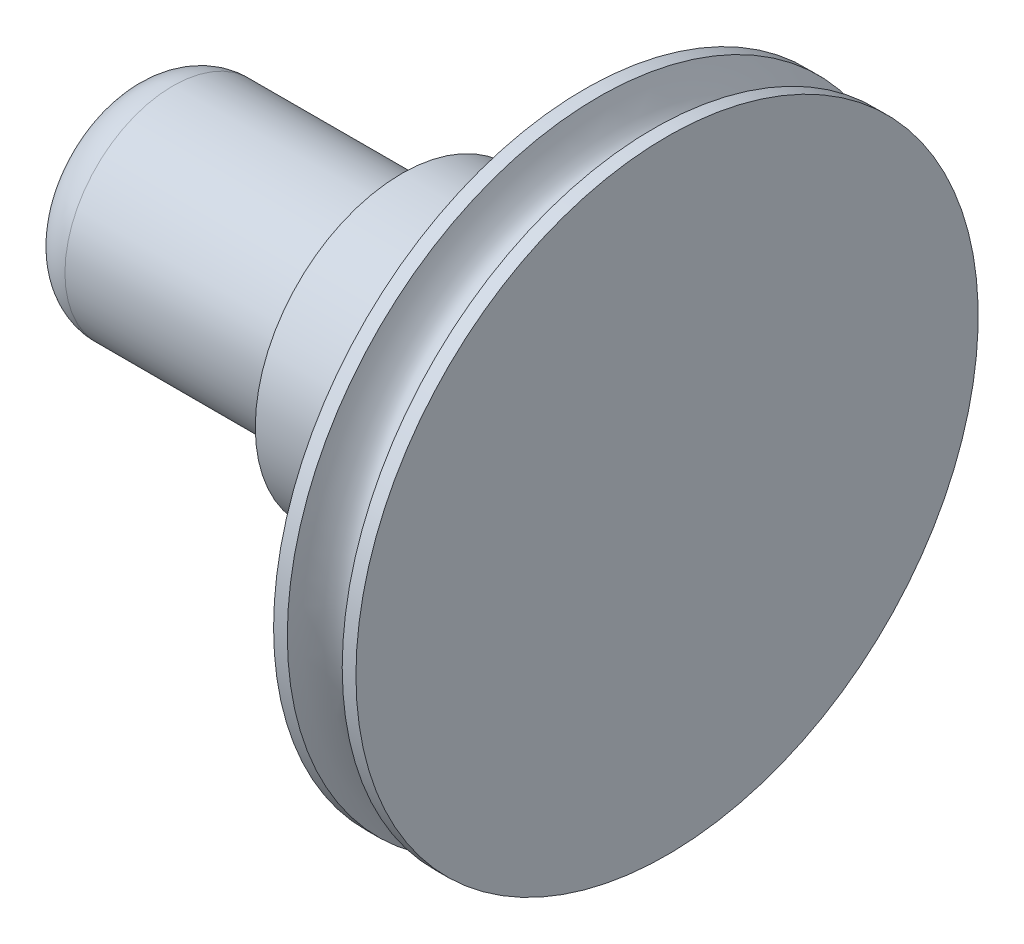
from build123d import *

# Parameters (mm, degrees)
FILLET1_R = 2.5


with BuildPart() as part:
    # Sketch1 → Revolve1 (revolve)
    with BuildSketch(Plane(origin=(0, 0, 0), x_dir=(1, 0, 0), z_dir=(0, 1, 0)), mode=Mode.PRIVATE) as revolve1_sk:
        with BuildLine():
            Line((0, 0), (4.5, 0))
            Line((4.5, 0), (4.5, 17))
            Line((4.5, 17), (3.75, 17))
            add(Edge.make_bspline(
                [(0.75, 17), (2.314018429, 12.999424212), (3.75, 17)],
                knots=[0, 0, 0, 1, 1, 1], degree=2))
            Line((0.75, 17), (0, 17))
            Line((0, 17), (0, 0))
        make_face()
    revolve(revolve1_sk.sketch.rotate(Axis((0, 0, 0), (1, 0, 0)), 180), axis=Axis((0, 0, 0), (1, 0, 0)))

    # Sketch2 → Revolve2 (revolve)
    with BuildSketch(Plane(origin=(0, 0, 0), x_dir=(1, 0, 0), z_dir=(0, 1, 0)), mode=Mode.PRIVATE) as revolve2_sk:
        Polygon((0, 8), (-6.812347486, 8), (-10, 8), (-10, 5.9), (-25, 5.9), (-25, 0), (0, 0), align=None)
    revolve(revolve2_sk.sketch.rotate(Axis((-25, 0, 0), (1, 0, 0)), 180), axis=Axis((-25, 0, 0), (1, 0, 0)))

    # Fillet1
    fillet1_edges = [part.edges().sort_by_distance(p)[0] for p in [
        (-25, 0, -5.9),
    ]]
    fillet(fillet1_edges, radius=FILLET1_R)


solid = part.part
